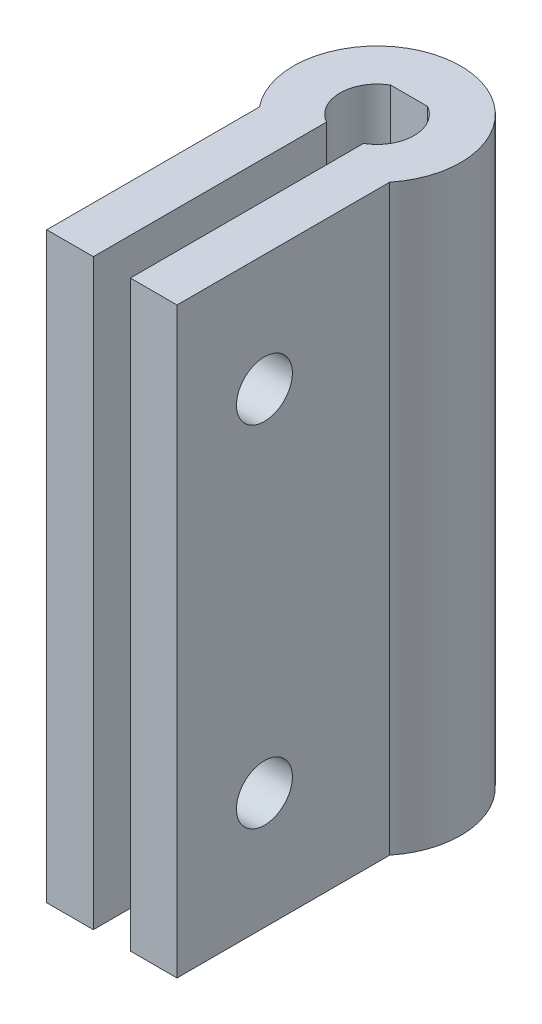
from build123d import *

# Parameters (mm, degrees)
BOSS_EXTRUDE1_DEPTH  = 50
M4_CLEARANCE_HOLE1_D = 4.8


with BuildPart() as part:
    # Sketch1 → Boss-Extrude1 (new body)
    with BuildSketch(Plane(origin=(0, 0, 0), x_dir=(1, 0, 0), z_dir=(0, 1, 0))):
        with BuildLine():
            Line((-1.5875, -2.749630657), (-1.5875, -22.749630657))
            Line((-1.5875, -22.749630657), (-5.5875, -22.749630657))
            Line((-5.5875, -22.749630657), (-5.5875, -4.501163044))
            ThreePointArc((-5.5875, -4.501163044), (0, 7.175), (5.5875, -4.501163044))
            Line((5.5875, -4.501163044), (5.5875, -22.749630657))
            Line((5.5875, -22.749630657), (1.5875, -22.749630657))
            Line((1.5875, -22.749630657), (1.5875, -2.749630657))
            ThreePointArc((1.5875, -2.749630657), (3.175, 0), (1.5875, 2.749630657))
            Line((1.5875, 2.749630657), (-1.5875, 2.749630657))
            ThreePointArc((-1.5875, 2.749630657), (-3.175, 0), (-1.5875, -2.749630657))
        make_face()
    extrude(amount=BOSS_EXTRUDE1_DEPTH)

    # M4 Clearance Hole1 (through all)
    with Locations(Plane(origin=(5.5875, 0, 0), x_dir=(0, 0, -1), z_dir=(1, 0, 0))):
        with Locations((-15.249630657, 40), (-15.249630657, 10)):
            Hole(M4_CLEARANCE_HOLE1_D / 2)


solid = part.part
